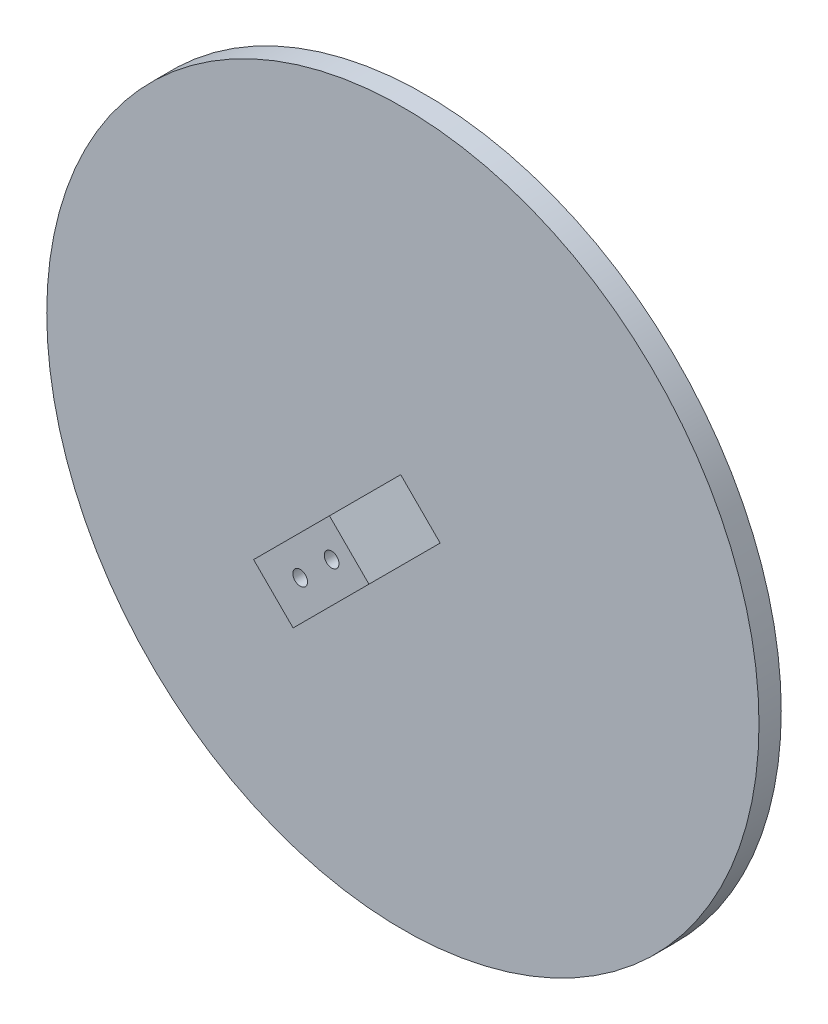
from build123d import *

# Parameters (mm, degrees)
BOSS_EXTRUDE1_DEPTH = 16
SKETCH3_R           = 1.65
CUT_EXTRUDE1_DEPTH  = 27
SKETCH4_R           = 80
BOSS_EXTRUDE2_DEPTH = 5
SKETCH5_R           = 1.65
CUT_EXTRUDE3_DEPTH  = 5


with BuildPart() as part:
    # Sketch2 → Boss-Extrude1 (new body)
    with BuildSketch(Plane(origin=(0, 0, -22.7), x_dir=(-1, 0, 0), z_dir=(0, 0, -1))):
        Polygon((-119.618145114, 49.851633515), (-102.581939837, 32.815428238), (-93.714762751, 41.682605324), (-110.750968028, 58.718810601), align=None)
    extrude(amount=BOSS_EXTRUDE1_DEPTH)

    # Sketch3 → Cut-Extrude1 (cut)
    with BuildSketch(Plane(origin=(0, 0, -22.7), x_dir=(-1, 0, 0), z_dir=(0, 0, -1))):
        with Locations(Location((-111.238929757, 50.452674279, 0), (0, 0, 180))):
            Circle(SKETCH3_R)
        with Locations(Location((-104.167861945, 43.381606467, 0), (0, 0, 180))):
            Circle(SKETCH3_R)
    extrude(amount=CUT_EXTRUDE1_DEPTH, mode=Mode.SUBTRACT)

    # Sketch4 → Boss-Extrude2 (add)
    with BuildSketch(Plane(origin=(0, 0, -38.7), x_dir=(-1, 0, 0), z_dir=(0, 0, -1))):
        with Locations((-111.238929757, 50.452674279)):
            Circle(SKETCH4_R)
    extrude(amount=BOSS_EXTRUDE2_DEPTH)

    # Sketch5 → Cut-Extrude3 (cut)
    with BuildSketch(Plane(origin=(0, 0, -38.7), x_dir=(-1, 0, 0), z_dir=(0, 0, -1))):
        with Locations((-111.238929757, 50.452674279)):
            Circle(SKETCH5_R)
        with Locations((-104.167861945, 43.381606467)):
            Circle(SKETCH5_R)
    extrude(amount=CUT_EXTRUDE3_DEPTH, mode=Mode.SUBTRACT)


solid = part.part
